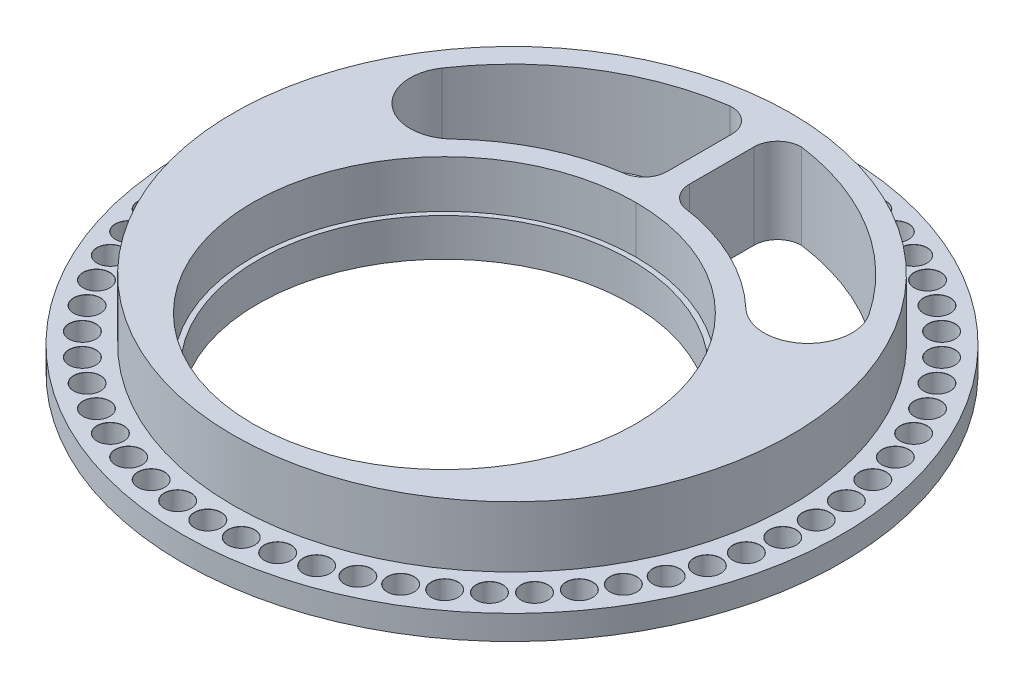
from build123d import *

# Parameters (mm, degrees)
BOSS_EXTRUDE1_DEPTH             = 4.5212
BOSS_EXTRUDE1_DEPTH_BACK        = 0.05588
SKETCH1_R                       = 61.9125
SKETCH1_R_2                     = 35.052
SKETCH3_R                       = 52.3875
BOSS_EXTRUDE2_DEPTH             = 11.43
SKETCH4_R                       = 35.052
CUT_EXTRUDE1_DEPTH              = 90.008662065
SKETCH9_R                       = 36.000000009
CUT_EXTRUDE3_DEPTH              = 8.89
F_5_0MM_DOWEL_HOLE1_D           = 5
F_5_0MM_DOWEL_HOLE1_CSINK_D     = 5.05
F_5_0MM_DOWEL_HOLE1_CSINK_ANGLE = 90
CIRPATTERN1_COUNT               = 60
CUT_EXTRUDE5_DEPTH              = 90.008662065
BOSS_EXTRUDE3_REACH             = 89.923
BOSS_EXTRUDE3_DIRECTION_2_REACH = 89.923


with BuildPart() as part:
    # Sketch1 → Boss-Extrude1 (new, two sides: drawn at the far end of the back side and taken through both)
    with BuildSketch(Plane(origin=(0, 0, 0), x_dir=(1, 0, 0), z_dir=(0, 1, 0)).offset(-BOSS_EXTRUDE1_DEPTH_BACK)):
        with Locations(Location((0, 0, 0), (0, 0, 270))):
            Circle(SKETCH1_R)
        with Locations(Location((0, -12.7, 0), (0, 0, 270))):
            Circle(SKETCH1_R_2, mode=Mode.SUBTRACT)
    extrude(amount=BOSS_EXTRUDE1_DEPTH + BOSS_EXTRUDE1_DEPTH_BACK)

    # Sketch3 → Boss-Extrude2 (add)
    with BuildSketch(Plane(origin=(0, 4.5212, 0), x_dir=(1, 0, 0), z_dir=(0, 1, 0))):
        with Locations(Location((0, 0, 0), (0, 0, 270))):
            Circle(SKETCH3_R)
    extrude(amount=BOSS_EXTRUDE2_DEPTH)

    # Sketch4 → Cut-Extrude1 (cut, through all)
    with BuildSketch(Plane.XZ.offset(0.05588)):
        with Locations(Location((0, 12.7, 0), (0, 0, 90))):
            Circle(SKETCH4_R)
    extrude(amount=-CUT_EXTRUDE1_DEPTH, mode=Mode.SUBTRACT)

    # Sketch9 → Cut-Extrude3 (cut)
    with BuildSketch(Plane(origin=(0, 15.9512, 0), x_dir=(1, 0, 0), z_dir=(0, 1, 0))):
        with Locations(Location((0, -12.7, 0), (0, 0, 270))):
            Circle(SKETCH9_R)
    extrude(amount=-CUT_EXTRUDE3_DEPTH, mode=Mode.SUBTRACT)

    # Ø5.0mm Dowel Hole1 (through all)
    with Locations(Plane(origin=(0, 4.5212, 0), x_dir=(1, 0, 0), z_dir=(0, 1, 0))):
        with Locations((0, 57.15)):
            f_5_0mm_dowel_hole1 = CounterSinkHole(F_5_0MM_DOWEL_HOLE1_D / 2, F_5_0MM_DOWEL_HOLE1_CSINK_D / 2, counter_sink_angle=F_5_0MM_DOWEL_HOLE1_CSINK_ANGLE)

    # CirPattern1: Ø5.0mm Dowel Hole1 ×60 about axis
    cirpattern1_axis = Axis((0, 0, 0), (0, 1, 0))
    for i in range(1, CIRPATTERN1_COUNT):
        add(f_5_0mm_dowel_hole1.rotate(cirpattern1_axis, i * 360 / CIRPATTERN1_COUNT), mode=Mode.SUBTRACT)

    # Sketch10 → Cut-Extrude5 (cut, through all)
    with BuildSketch(Plane(origin=(0, 15.9512, 0), x_dir=(1, 0, 0), z_dir=(0, 1, 0))):
        with BuildLine():
            ThreePointArc((-27.568698422, 16.370448294), (0, 27.364000009), (27.568698422, 16.370448294))
            ThreePointArc((27.568698422, 16.370448294), (38.57955057, 16.056999754), (40.099152196, 26.966991775))
            ThreePointArc((40.099152196, 26.966991775), (0, 48.3235), (-40.099152196, 26.966991775))
            ThreePointArc((-40.099152196, 26.966991775), (-38.57955057, 16.056999754), (-27.568698422, 16.370448294))
        make_face()
    extrude(amount=-CUT_EXTRUDE5_DEPTH, mode=Mode.SUBTRACT)

    # Boss-Extrude3: up to this face of the body (flat: up to its plane)
    boss_extrude3_end = Plane(part.part.faces().sort_by_distance((0, 15.9512, -50.90575774))[0])
    # Sketch15 → Boss-Extrude3 (add, up to the picked face)
    with BuildSketch(Plane(origin=(0, 7.94766, 0), x_dir=(1, 0, 0), z_dir=(0, 1, 0)), mode=Mode.PRIVATE) as boss_extrude3_sk1:
        with BuildLine():
            ThreePointArc((2.032, 31.29096677), (2.926793499, 28.616259533), (5.250924096, 27.018407481))
            ThreePointArc((5.250924096, 27.018407481), (-0.056014781, 27.363960851), (-5.361966653, 27.003569239))
            ThreePointArc((-5.361966653, 27.003569239), (-3.020045747, 28.598028587), (-2.11713302, 31.283478782))
            Line((-2.11713302, 31.283478782), (-2.11713302, 43.39578959))
            ThreePointArc((-2.11713302, 43.39578959), (-3.543125847, 46.658245825), (-6.906163701, 47.827456081))
            ThreePointArc((-6.906163701, 47.827456081), (-0.203176512, 48.32307287), (6.503741299, 47.883838624))
            ThreePointArc((6.503741299, 47.883838624), (3.343379097, 46.591449005), (2.032, 43.438919063))
            Line((2.032, 43.438919063), (2.032, 31.29096677))
        make_face()
    boss_extrude3_tool1 = split(extrude(boss_extrude3_sk1.sketch, amount=BOSS_EXTRUDE3_REACH, mode=Mode.PRIVATE), bisect_by=boss_extrude3_end, keep=Keep.BOTH, mode=Mode.PRIVATE)
    add(boss_extrude3_tool1.solids().sort_by(Axis((-0.049426, 7.94766, -38.213586), (0, 1, 0)))[0])

    # Boss-Extrude3 direction 2: up to this face of the body (flat: up to its plane)
    boss_extrude3_direction_2_end = Plane(part.part.faces().sort_by_distance((0, -0.05588, -60.161350056))[0])
    # Sketch15 → Boss-Extrude3 direction 2 (add, up to the picked face)
    with BuildSketch(Plane(origin=(0, 7.94766, 0), x_dir=(1, 0, 0), z_dir=(0, 1, 0)), mode=Mode.PRIVATE) as boss_extrude3_direction_2_sk1:
        with BuildLine():
            ThreePointArc((2.032, 31.29096677), (2.926793499, 28.616259533), (5.250924096, 27.018407481))
            ThreePointArc((5.250924096, 27.018407481), (-0.056014781, 27.363960851), (-5.361966653, 27.003569239))
            ThreePointArc((-5.361966653, 27.003569239), (-3.020045747, 28.598028587), (-2.11713302, 31.283478782))
            Line((-2.11713302, 31.283478782), (-2.11713302, 43.39578959))
            ThreePointArc((-2.11713302, 43.39578959), (-3.543125847, 46.658245825), (-6.906163701, 47.827456081))
            ThreePointArc((-6.906163701, 47.827456081), (-0.203176512, 48.32307287), (6.503741299, 47.883838624))
            ThreePointArc((6.503741299, 47.883838624), (3.343379097, 46.591449005), (2.032, 43.438919063))
            Line((2.032, 43.438919063), (2.032, 31.29096677))
        make_face()
    boss_extrude3_direction_2_tool1 = split(extrude(boss_extrude3_direction_2_sk1.sketch, amount=-BOSS_EXTRUDE3_DIRECTION_2_REACH, mode=Mode.PRIVATE), bisect_by=boss_extrude3_direction_2_end, keep=Keep.BOTH, mode=Mode.PRIVATE)
    add(boss_extrude3_direction_2_tool1.solids().sort_by(Axis((-0.049426, 7.94766, -38.213586), (0, -1, 0)))[0])


solid = part.part
